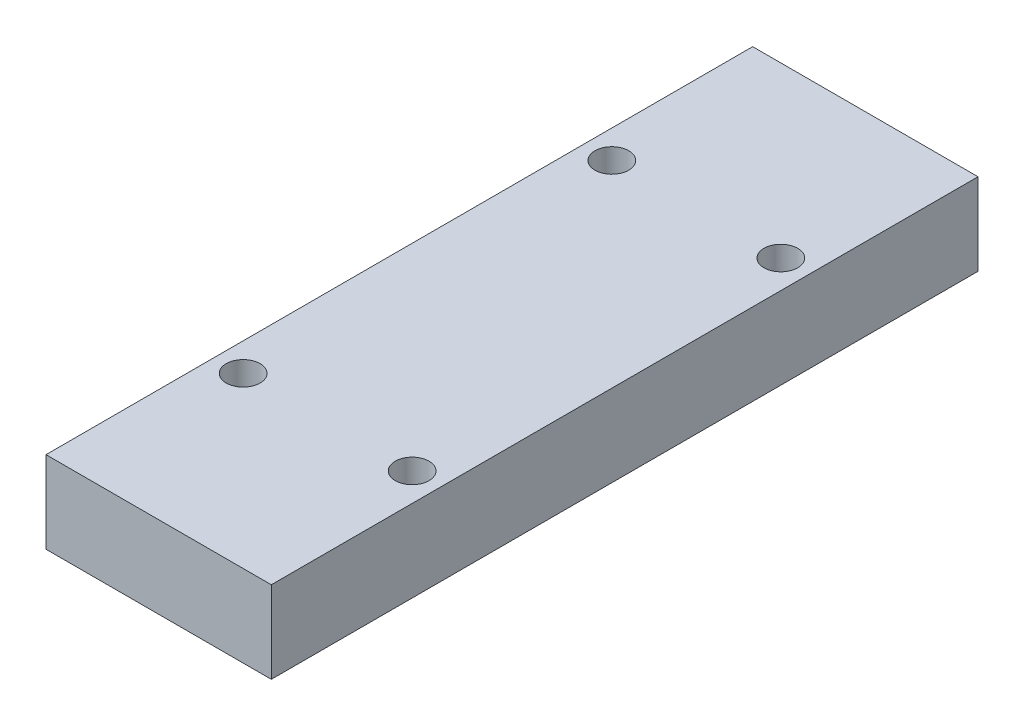
from build123d import *

# Parameters (mm, degrees)
SKETCH_1_W             = 22
SKETCH_1_H             = 8
EXTRUDE_1_DEPTH        = 69
HOLE_WIZARD_M4_1_D     = 3.3
HOLE_WIZARD_M4_1_DEPTH = 7
HOLE_WIZARD_M4_1_TIP   = 0.991420021


with BuildPart() as part:
    # 草图1 → 凸台-拉伸1 (new body)
    with BuildSketch(Plane.XY):
        Rectangle(SKETCH_1_W, SKETCH_1_H)
    extrude(amount=EXTRUDE_1_DEPTH)

    # M4 螺纹孔1
    with Locations(Plane(origin=(-8.25, 4, 16.5), x_dir=(0, 0, 1), z_dir=(0, 1, 0))):
        with Locations((0, 0), (0, 16.5), (36, 16.5), (36, 0)):
            Hole(HOLE_WIZARD_M4_1_D / 2, depth=HOLE_WIZARD_M4_1_DEPTH)
            with Locations((0, 0, -(HOLE_WIZARD_M4_1_DEPTH + HOLE_WIZARD_M4_1_TIP / 2))):  # 118° drill point
                Cone(0, HOLE_WIZARD_M4_1_D / 2, HOLE_WIZARD_M4_1_TIP, mode=Mode.SUBTRACT)


solid = part.part
